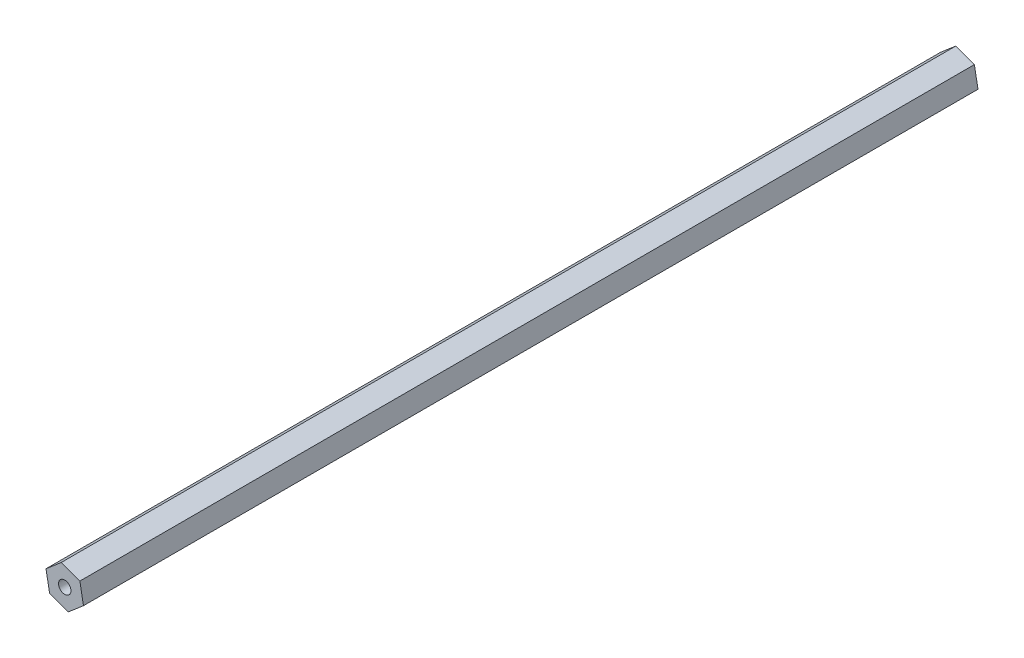
from build123d import *

# Parameters (mm, degrees)
BOSS_EXTRUDE1_DEPTH = 180
SKETCH4_R           = 1.25
CUT_EXTRUDE1_DEPTH  = 5


with BuildPart() as part:
    # Sketch1 → Boss-Extrude1 (new body)
    with BuildSketch(Plane.XY):
        Polygon((3.770690633, -1.334875333), (3.041381265, 2.598076211), (-0.729309367, 3.932951544), (-3.770690633, 1.334875333), (-3.041381265, -2.598076211), (0.729309367, -3.932951544), align=None)
    extrude(amount=BOSS_EXTRUDE1_DEPTH)

    # Sketch4 → Cut-Extrude1 (cut)
    with BuildSketch(Plane(origin=(0, 0, 0), x_dir=(-1, 0, 0), z_dir=(0, 0, -1))):
        Circle(SKETCH4_R)
    cut_extrude1 = extrude(amount=-CUT_EXTRUDE1_DEPTH, mode=Mode.SUBTRACT)

    # Mirror1: Cut-Extrude1 across plane
    add(cut_extrude1.mirror(Plane.XY.offset(90)), mode=Mode.SUBTRACT)


solid = part.part
